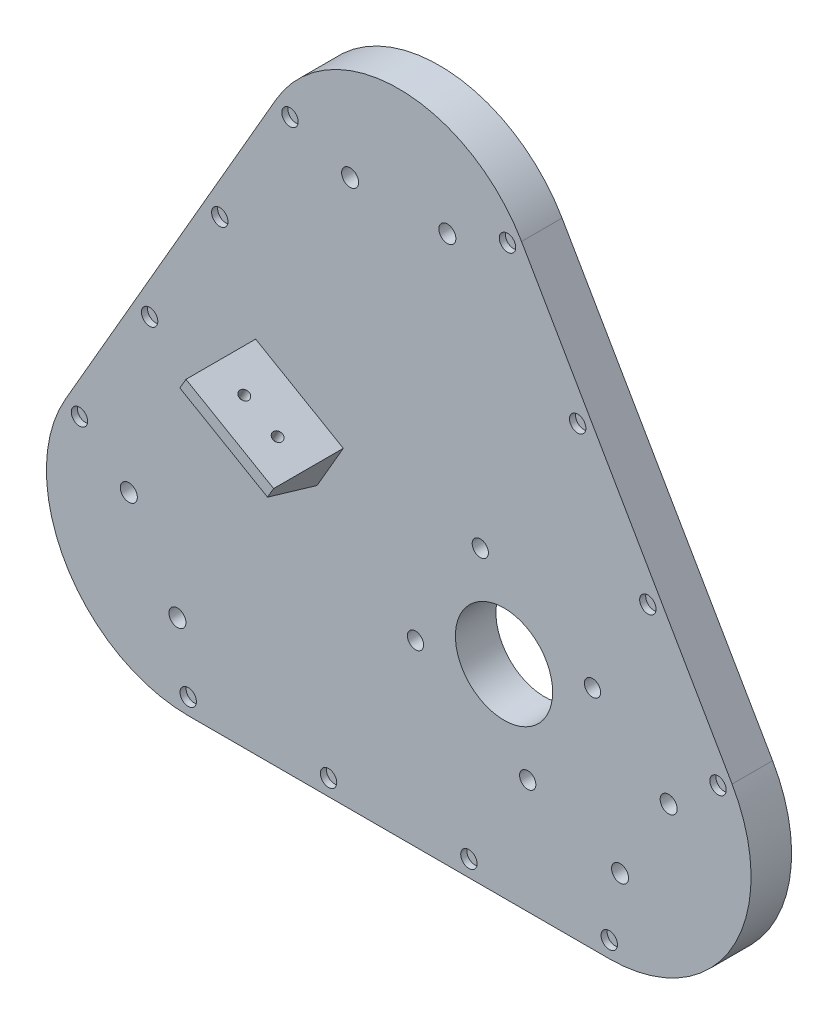
from build123d import *

# Parameters (mm, degrees)
ESBO_O1_R                = 2.1
ESBO_O1_R_2              = 2
ESBO_O1_R_3              = 12
RESSALTO_EXTRUS_O1_DEPTH = 10
RESSALTO_EXTRUS_O2_DEPTH = 17.2
ESBO_O3_R                = 1.2
CORTE_EXTRUS_O1_DEPTH    = 3
NERVURA1_REACH           = 155.293
ESBO_O4_WALL_W           = 333.586365546
ESBO_O4_WALL_H           = 2.5
ESBO_O5_R                = 2.025
CORTE_EXTRUS_O2_DEPTH    = 1.5


with BuildPart() as part:
    # Esboço1 → Ressalto-extrusão1 (new body)
    with BuildSketch(Plane.XY):
        with BuildLine():
            Line((-51.961524227, -65), (51.961524227, -65))
            ThreePointArc((51.961524227, -65), (82.27241336, -47.5), (82.27241336, -12.5))
            Line((82.27241336, -12.5), (30.310889132, 77.5))
            ThreePointArc((30.310889132, 77.5), (0, 95), (-30.310889132, 77.5))
            Line((-30.310889132, 77.5), (-82.27241336, -12.5))
            ThreePointArc((-82.27241336, -12.5), (-82.27241336, -47.5), (-51.961524227, -65))
        make_face()
        with Locations((-12, 70)):
            Circle(ESBO_O1_R, mode=Mode.SUBTRACT)
        with Locations((-66.621778265, -24.607695155)):
            Circle(ESBO_O1_R, mode=Mode.SUBTRACT)
        with Locations(Location((12, 70, 0), (0, 0, 180))):
            Circle(ESBO_O1_R, mode=Mode.SUBTRACT)
        with Locations(Location((-54.621778265, -45.392304845, 0), (0, 0, 180))):
            Circle(ESBO_O1_R, mode=Mode.SUBTRACT)
        with Locations((66.621778265, -24.607695155)):
            Circle(ESBO_O1_R, mode=Mode.SUBTRACT)
        with Locations((54.621778265, -45.392304845)):
            Circle(ESBO_O1_R, mode=Mode.SUBTRACT)
        with Locations((31.83350832, -36.842746207)):
            Circle(ESBO_O1_R_2, mode=Mode.SUBTRACT)
        with Locations((25.980762114, -15)):
            Circle(ESBO_O1_R_3, mode=Mode.SUBTRACT)
        with Locations((4.138015907, -20.852746207)):
            Circle(ESBO_O1_R_2, mode=Mode.SUBTRACT)
        with Locations((20.128015907, 6.842746207)):
            Circle(ESBO_O1_R_2, mode=Mode.SUBTRACT)
        with Locations((47.82350832, -9.147253793)):
            Circle(ESBO_O1_R_2, mode=Mode.SUBTRACT)
    extrude(amount=RESSALTO_EXTRUS_O1_DEPTH)

    # Esboço2 → Ressalto-extrusão2 (add)
    with BuildSketch(Plane.XY.offset(10)):
        Polygon((-36.821647177, 21.223079253), (-15.188309322, 8.693167311), (-13.684719889, 11.289167854), (-35.318057744, 23.819079795), align=None)
    extrude(amount=RESSALTO_EXTRUS_O2_DEPTH)

    # Esboço3 → Corte-extrusão1 (cut)
    with BuildSketch(Plane(origin=(-0.045026547, -0.077739931, 0), x_dir=(0.8653335141925842, -0.5011964776563306, 0), z_dir=(-0.5011964776563306, -0.8653335141925842, 0))):
        with Locations((-34.749937916, 19.5)):
            Circle(ESBO_O3_R)
        with Locations((-25.249937916, 19.5)):
            Circle(ESBO_O3_R)
    extrude(amount=-CORTE_EXTRUS_O1_DEPTH, mode=Mode.SUBTRACT)

    # Esboço4 wall → Nervura1 (add, up to next)
    with BuildSketch(Plane(origin=(-39.954125162, 15.814744789, 16.374682453), x_dir=(-0.250598238796, -0.432666757113, -0.866025403786), z_dir=(-0.434048881938, -0.749400806038, 0.499999999998)), mode=Mode.PRIVATE) as nervura1_sk1:
        with Locations((0, 1.25)):
            Rectangle(ESBO_O4_WALL_W, ESBO_O4_WALL_H)
    nervura1_tool1 = extrude(nervura1_sk1.sketch, amount=-NERVURA1_REACH, mode=Mode.PRIVATE) - part.part
    nervura1 = nervura1_tool1.solids().sort_by_distance((-39.954125162, 15.814744789, 16.374682453))[0]
    add(nervura1)

    # Espelhar1: Nervura1 across plane
    add(nervura1.mirror(Plane(origin=(-25.959951703, 15.035863214, 0), x_dir=(0, 0, 1), z_dir=(-0.8653335141925849, 0.5011964776563297, 0))))

    # Esboço5 → Corte-extrusão2 (cut)
    with BuildSketch(Plane.XY.offset(10)):
        with Locations((-78.808311744, -14.5)):
            Circle(ESBO_O5_R)
        with Locations((-51.961524227, -61)):
            Circle(ESBO_O5_R)
        with Locations((26.846787517, 75.5)):
            Circle(ESBO_O5_R)
        with Locations((44.166787517, 45.500880013)):
            Circle(ESBO_O5_R)
        with Locations((61.486787517, 15.501760026)):
            Circle(ESBO_O5_R)
        with Locations((78.806787517, -14.497359961)):
            Circle(ESBO_O5_R)
        with Locations((-61.488311744, 15.499119987)):
            Circle(ESBO_O5_R)
        with Locations((-44.168311744, 45.498239974)):
            Circle(ESBO_O5_R)
        with Locations((-26.848311744, 75.497359961)):
            Circle(ESBO_O5_R)
        with Locations((-17.321524227, -61)):
            Circle(ESBO_O5_R)
        with Locations((17.318475773, -61)):
            Circle(ESBO_O5_R)
        with Locations((51.958475773, -61)):
            Circle(ESBO_O5_R)
    extrude(amount=-CORTE_EXTRUS_O2_DEPTH, mode=Mode.SUBTRACT)


solid = part.part
